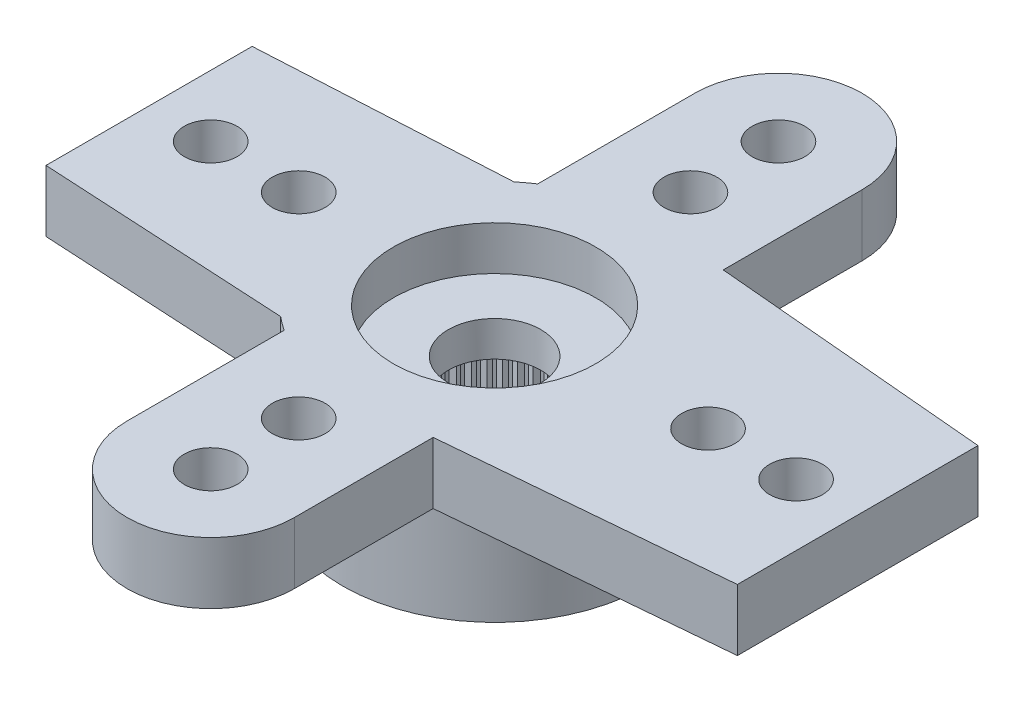
from build123d import *

# Parameters (mm, degrees)
RESSALTO_EXTRUS_O1_DEPTH = 1.4
ESBO_O2_R                = 3.45
RESSALTO_EXTRUS_O2_DEPTH = 2.4
FURO1_D                  = 1.2
PADR_O_LINEAR1_COUNT     = 6
PADR_O_LINEAR1_PITCH     = 2
RESSALTO_EXTRUS_O3_DEPTH = 1.4
FURO2_D                  = 1.2
PADR_O_LINEAR2_COUNT     = 7
PADR_O_LINEAR2_PITCH     = 2
RESSALTO_EXTRUS_O4_DEPTH = 1.4
FURO3_D                  = 1.2
PADR_O_LINEAR3_COUNT     = 2
PADR_O_LINEAR3_PITCH     = 2
PADR_OCIRCULAR1_COUNT    = 2
PADR_OCIRCULAR1_COPY_1_D = 1.2
FURO4_D                  = 4.95
FURO4_DEPTH              = 2
FURO5_D                  = 4.6
FURO5_DEPTH              = 1
FURO6_D                  = 2.1
RESSALTO_EXTRUS_O5_START = -2
RESSALTO_EXTRUS_O5_DEPTH = 2
PADR_OCIRCULAR2_COUNT    = 60
CUT_EXTRUDE3_DEPTH       = 10


with BuildPart() as part:
    # Esboço1 → Ressalto-extrusão1 (new body)
    with BuildSketch(Plane(origin=(0, 0, 0), x_dir=(1, 0, 0), z_dir=(0, 1, 0))):
        with BuildLine():
            Line((-14.159121967, 1.99702088), (-2.209072203, 2.65))
            ThreePointArc((-2.209072203, 2.65), (3.45, 0), (-2.209072203, -2.65))
            Line((-2.209072203, -2.65), (-14.159121967, -1.99702088))
            ThreePointArc((-14.159121967, -1.99702088), (-16.05, 0), (-14.159121967, 1.99702088))
        make_face()
    extrude(amount=-RESSALTO_EXTRUS_O1_DEPTH)

    # Esboço2 → Ressalto-extrusão2 (add)
    with BuildSketch(Plane.XZ.offset(1.4)):
        with Locations(Location((0, 0, 0), (0, 0, 90))):
            Circle(ESBO_O2_R)
    extrude(amount=RESSALTO_EXTRUS_O2_DEPTH)

    # Furo1 (through all)
    with Locations(Plane(origin=(0, 0, 0), x_dir=(1, 0, 0), z_dir=(0, 1, 0))):
        with Locations((-14.45, 0)):
            furo1 = Hole(FURO1_D / 2)

    # Padrão linear1: Furo1 ×6
    with Locations(*[(i * PADR_O_LINEAR1_PITCH, 0, 0) for i in range(1, PADR_O_LINEAR1_COUNT)]):
        add(furo1, mode=Mode.SUBTRACT)

    # Esboço12 → Ressalto-extrusão3 (add)
    with BuildSketch(Plane(origin=(0, 0, 0), x_dir=(1, 0, 0), z_dir=(0, 1, 0))):
        with BuildLine():
            Line((0.304103343, 3.436571134), (16.626291793, 1.99221515))
            ThreePointArc((16.626291793, 1.99221515), (18.45, 0), (16.626291793, -1.99221515))
            Line((16.626291793, -1.99221515), (0.304103343, -3.436571134))
            ThreePointArc((0.304103343, -3.436571134), (3.45, 0), (0.304103343, 3.436571134))
        make_face()
    extrude(amount=-RESSALTO_EXTRUS_O3_DEPTH)

    # Furo2 (through all)
    with Locations(Plane(origin=(0, 0, 0), x_dir=(1, 0, 0), z_dir=(0, 1, 0))):
        with Locations((16.85, 0)):
            furo2 = Hole(FURO2_D / 2)

    # Padrão linear2: Furo2 ×7
    with Locations(*[(-i * PADR_O_LINEAR2_PITCH, 0, 0) for i in range(1, PADR_O_LINEAR2_COUNT)]):
        add(furo2, mode=Mode.SUBTRACT)

    # Esboço16 → Ressalto-extrusão4 (add)
    with BuildSketch(Plane(origin=(0, 0, 0), x_dir=(1, 0, 0), z_dir=(0, 1, 0))):
        with BuildLine():
            Line((-1.9, -6.45), (-1.9, 6.45))
            ThreePointArc((-1.9, 6.45), (0, 8.35), (1.9, 6.45))
            Line((1.9, 6.45), (1.9, -6.45))
            ThreePointArc((1.9, -6.45), (0, -8.35), (-1.9, -6.45))
        make_face()
    extrude(amount=-RESSALTO_EXTRUS_O4_DEPTH)

    # Furo3 (through all)
    with Locations(Plane(origin=(0, 0, 0), x_dir=(1, 0, 0), z_dir=(0, 1, 0))):
        with Locations((0, -6.45)):
            furo3 = Hole(FURO3_D / 2)

    # Padrão linear3: Furo3 ×2
    with Locations(*[(0, 0, -i * PADR_O_LINEAR3_PITCH) for i in range(1, PADR_O_LINEAR3_COUNT)]):
        add(furo3, mode=Mode.SUBTRACT)

    # PadrãoCircular1: Furo3 ×2 about axis
    padr_ocircular1_axis = Axis((0, 0, 0), (0, 1, 0))
    for i in range(1, PADR_OCIRCULAR1_COUNT):
        add(furo3.rotate(padr_ocircular1_axis, i * 360 / PADR_OCIRCULAR1_COUNT), mode=Mode.SUBTRACT)

    # PadrãoCircular1 copy 1 (through all)
    with Locations(Plane(origin=(0, 0, 2), x_dir=(-1, 0, 0), z_dir=(0, 1, 0))):
        with Locations((0, -6.45)):
            Hole(PADR_OCIRCULAR1_COPY_1_D / 2)

    # Furo4
    with Locations(Plane(origin=(0, -3.8, 0), x_dir=(-1, 0, 0), z_dir=(0, -1, 0))):
        with Locations((0, 0)):
            Hole(FURO4_D / 2, depth=FURO4_DEPTH)

    # Furo5
    with Locations(Plane(origin=(0, 0, 0), x_dir=(1, 0, 0), z_dir=(0, 1, 0))):
        with Locations((0, 0)):
            Hole(FURO5_D / 2, depth=FURO5_DEPTH)

    # Furo6 (through all)
    with Locations(Plane(origin=(0, 0, 0), x_dir=(1, 0, 0), z_dir=(0, 1, 0))):
        with Locations((0, 0)):
            Hole(FURO6_D / 2)

    # Esboço11 → Ressalto-extrusão5 (add)
    with BuildSketch(Plane.XZ.offset(3.8).offset(RESSALTO_EXTRUS_O5_START)):
        with BuildLine():
            Line((-0.098056786, 2.473056786), (0, 2.375))
            Line((0, 2.375), (0.098056786, 2.473056786))
            ThreePointArc((0.098056786, 2.473056786), (0, 2.475), (-0.098056786, 2.473056786))
        make_face()
    ressalto_extrus_o5 = extrude(amount=RESSALTO_EXTRUS_O5_DEPTH)

    # PadrãoCircular2: Ressalto-extrusão5 ×60 about axis
    padr_ocircular2_axis = Axis((0, 0, 0), (0, 1, 0))
    for i in range(1, PADR_OCIRCULAR2_COUNT):
        add(ressalto_extrus_o5.rotate(padr_ocircular2_axis, i * 360 / PADR_OCIRCULAR2_COUNT))

    # Sketch1 → Cut-Extrude3 (cut)
    with BuildSketch(Plane(origin=(0, 0, 0), x_dir=(1, 0, 0), z_dir=(0, 1, 0))):
        Polygon((-7.85, 2.341766299), (-7.85, -2.341766299), (-20.571155991, -2.341766299), (-20.571155991, 2.301698607), align=None)
        Polygon((8.25, 2.733436047), (8.25, -2.733436047), (21.323447833, -2.733436047), (21.323447833, 2.572990153), align=None)
    extrude(amount=-CUT_EXTRUDE3_DEPTH, mode=Mode.SUBTRACT)


solid = part.part
